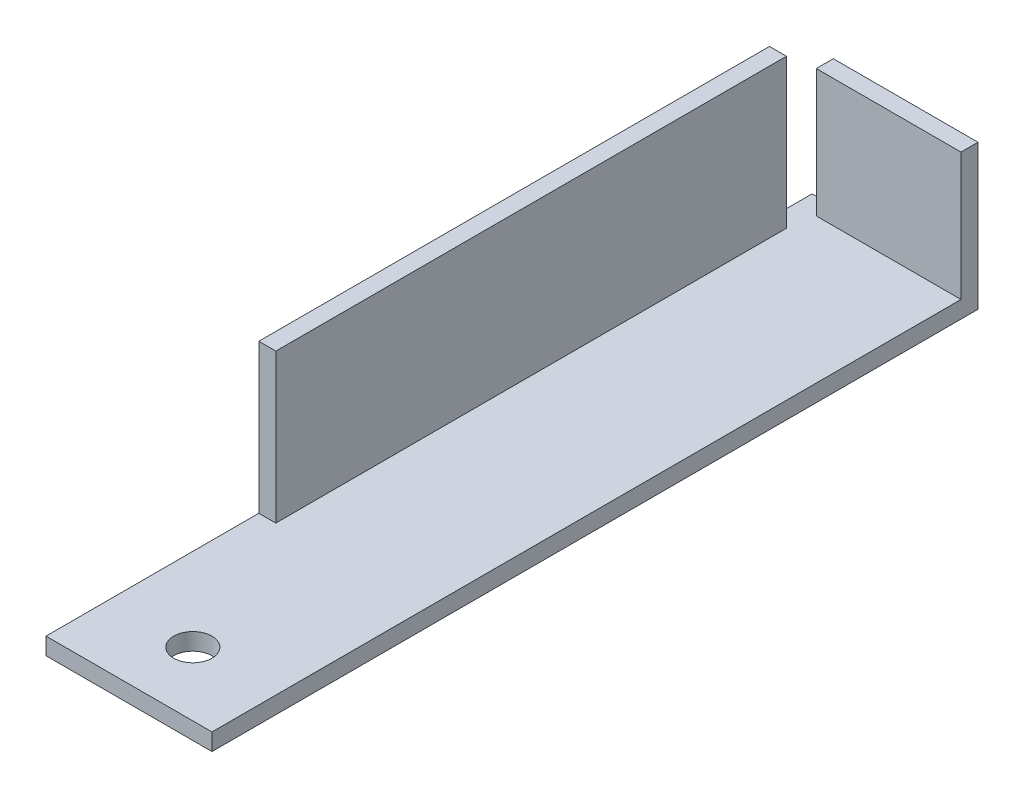
from build123d import *

# Parameters (mm, degrees)
BOSS_EXTRUDE1_DEPTH = 90
SKETCH8_W           = 25
SKETCH8_H           = 17.5
SKETCH8_W_2         = 5
CUT_EXTRUDE1_DEPTH  = 94.736332337
SKETCH2_W           = 17
SKETCH2_H           = 2
BOSS_EXTRUDE2_DEPTH = 15
SKETCH9_R           = 2.25
CUT_EXTRUDE2_DEPTH  = 94.736332337


with BuildPart() as part:
    # Sketch1 → Boss-Extrude1 (new body)
    with BuildSketch(Plane.XY):
        Polygon((0, 0), (0, 19.5), (2, 19.5), (2, 2), (19.5, 2), (19.5, 0), align=None)
    extrude(amount=BOSS_EXTRUDE1_DEPTH)

    # Sketch8 → Cut-Extrude1 (cut, through all)
    with BuildSketch(Plane(origin=(2, 0, 0), x_dir=(0, 0, -1), z_dir=(1, 0, 0))):
        with Locations((-77.5, 10.75)):
            Rectangle(SKETCH8_W, SKETCH8_H)
        with Locations((-2.5, 10.75)):
            Rectangle(SKETCH8_W_2, SKETCH8_H)
    extrude(amount=-CUT_EXTRUDE1_DEPTH, mode=Mode.SUBTRACT)

    # Sketch2 → Boss-Extrude2 (add)
    with BuildSketch(Plane(origin=(0, 2, 0), x_dir=(1, 0, 0), z_dir=(0, 1, 0))):
        with Locations((11, -1)):
            Rectangle(SKETCH2_W, SKETCH2_H)
    extrude(amount=BOSS_EXTRUDE2_DEPTH)

    # Sketch9 → Cut-Extrude2 (cut, through all)
    with BuildSketch(Plane(origin=(0, 2, 0), x_dir=(1, 0, 0), z_dir=(0, 1, 0))):
        with Locations(Location((9.75, -82.5, 0), (0, 0, 270))):
            Circle(SKETCH9_R)
    extrude(amount=-CUT_EXTRUDE2_DEPTH, mode=Mode.SUBTRACT)


solid = part.part
